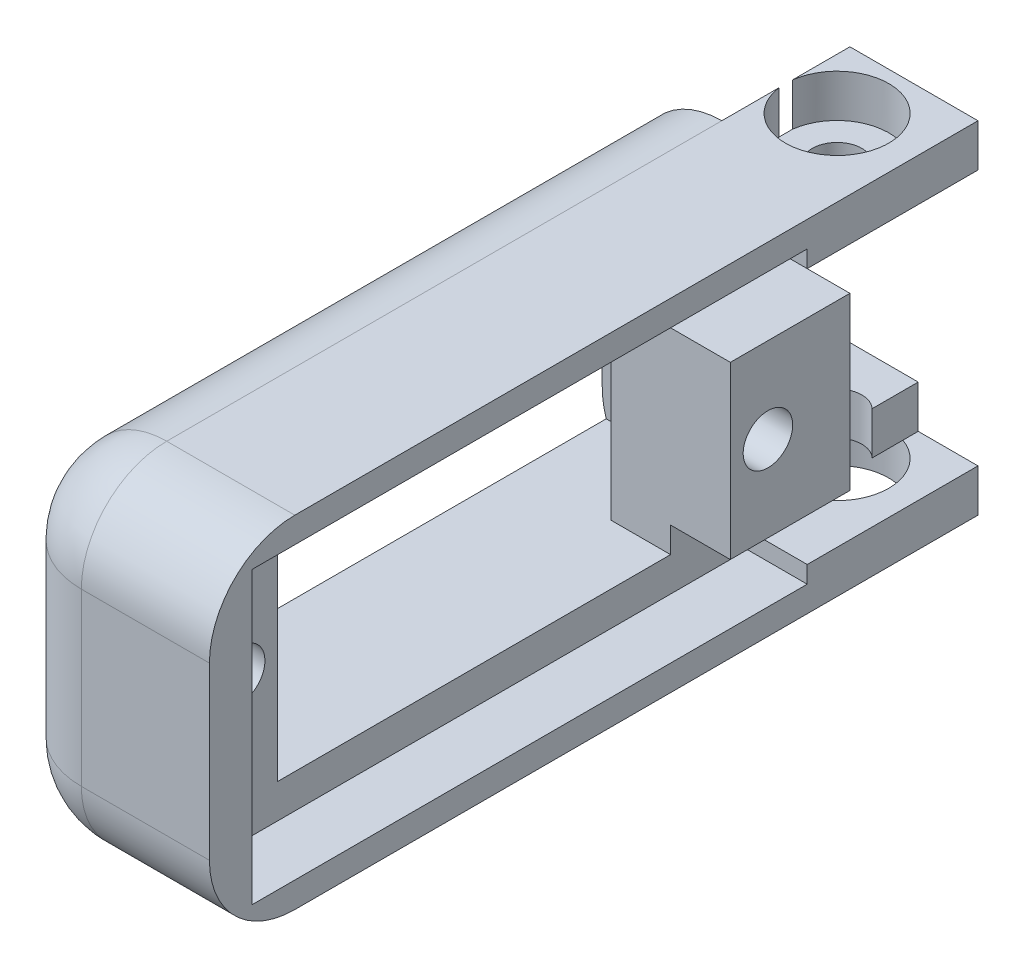
from build123d import *

# Parameters (mm, degrees)
SKETCH_1_W           = 25
SKETCH_1_H           = 37.5
EXTRUDE_1_DEPTH      = 20
FILLET_1_R           = 5
SKETCH_2_W           = 15
SKETCH_2_H           = 7.5
EXTRUDE_2_DEPTH      = 5
EXTRUDE_START        = -20
SKETCH_2_2_W         = 15
SKETCH_2_2_H         = 7.5
EXTRUDE_3_DEPTH      = 5
SKETCH_3_R           = 1.45
CUT_EXTRUDE_1_DEPTH  = 20
SKETCH_4_R           = 3.025
CUT_EXTRUDE_3_DEPTH  = 2.5
CUT_EXTRUDE_START    = -17.5
SKETCH_4_2_R         = 3.025
CUT_EXTRUDE_4_DEPTH  = 2.5
SKETCH_5_W           = 33
SKETCH_5_H           = 13
CUT_EXTRUDE_5_DEPTH  = 5.5
SKETCH_6_W           = 23
SKETCH_6_H           = 13
CUT_EXTRUDE_6_DEPTH  = 18.5
SKETCH_7_R           = 1.45
CUT_EXTRUDE_7_DEPTH  = 14.5
SKETCH_8_W           = 7
SKETCH_8_H           = 2.5
CUT_EXTRUDE_8_DEPTH  = 42.5
SKETCH_9_W           = 12
SKETCH_9_H           = 15
CUT_EXTRUDE_9_DEPTH  = 5
SKETCH_10_W          = 7
SKETCH_10_H          = 32.5
CUT_EXTRUDE_10_DEPTH = 1
CUT_EXTRUDE_START_2  = 15
SKETCH_10_2_W        = 7
SKETCH_10_2_H        = 32.5
CUT_EXTRUDE_11_DEPTH = 1
CUT_EXTRUDE_12_REACH = 40.332
SKETCH_11_R          = 3
SKETCH_12_R          = 4
EXTRUDE_4_DEPTH      = 5
SKETCH_13_W          = 22.08380712
SKETCH_13_H          = 47.260795407
CUT_EXTRUDE_13_DEPTH = 23


with BuildPart() as part:
    # Эскиз1 → Бобышка-Вытянуть1 (new body)
    with BuildSketch(Plane(origin=(0, 0, 0), x_dir=(1, 0, 0), z_dir=(0, 1, 0))):
        Rectangle(SKETCH_1_W, SKETCH_1_H)
    extrude(amount=EXTRUDE_1_DEPTH)

    # Скругление1
    fillet_1_edges = [part.edges().sort_by_distance(p)[0] for p in [
        (-12.5, 20, 0),
        (0, 20, 18.75),
        (12.5, 20, 0),
        (0, 0, 18.75),
        (-12.5, 0, 0),
        (12.5, 0, 0),
        (12.5, 10, 18.75),
        (-12.5, 10, 18.75),
    ]]
    fillet(fillet_1_edges, radius=FILLET_1_R)

    # Эскиз2 → Бобышка-Вытянуть2 (add)
    with BuildSketch(Plane(origin=(0, 20, 0), x_dir=(1, 0, 0), z_dir=(0, 1, 0))):
        with Locations((0, 22.5)):
            Rectangle(SKETCH_2_W, SKETCH_2_H)
    extrude(amount=-EXTRUDE_2_DEPTH)

    # Эскиз2<2> → Бобышка-Вытянуть3 (add)
    with BuildSketch(Plane(origin=(0, 20, 0), x_dir=(1, 0, 0), z_dir=(0, 1, 0)).offset(EXTRUDE_START)):
        with Locations((0, 22.5)):
            Rectangle(SKETCH_2_2_W, SKETCH_2_2_H)
    extrude(amount=EXTRUDE_3_DEPTH)

    # Эскиз3 → Вырез-Вытянуть1 (cut)
    with BuildSketch(Plane(origin=(0, 20, 0), x_dir=(1, 0, 0), z_dir=(0, 1, 0))):
        with Locations(Location((-4.5, 22.5, 0), (0, 0, 270))):
            Circle(SKETCH_3_R)
        with Locations(Location((4.5, 22.5, 0), (0, 0, 270))):
            Circle(SKETCH_3_R)
    extrude(amount=-CUT_EXTRUDE_1_DEPTH, mode=Mode.SUBTRACT)

    # Эскиз4 → Вырез-Вытянуть3 (cut)
    with BuildSketch(Plane(origin=(0, 20, 0), x_dir=(1, 0, 0), z_dir=(0, 1, 0))):
        with Locations((-4.5, 22.5)):
            Circle(SKETCH_4_R)
        with Locations((4.5, 22.5)):
            Circle(SKETCH_4_R)
    extrude(amount=-CUT_EXTRUDE_3_DEPTH, mode=Mode.SUBTRACT)

    # Эскиз4<2> → Вырез-Вытянуть4 (cut)
    with BuildSketch(Plane(origin=(0, 20, 0), x_dir=(1, 0, 0), z_dir=(0, 1, 0)).offset(CUT_EXTRUDE_START)):
        with Locations((-4.5, 22.5)):
            Circle(SKETCH_4_2_R)
        with Locations((4.5, 22.5)):
            Circle(SKETCH_4_2_R)
    extrude(amount=-CUT_EXTRUDE_4_DEPTH, mode=Mode.SUBTRACT)

    # Эскиз5 → Вырез-Вытянуть5 (cut)
    with BuildSketch(Plane.ZY.offset(12.5)):
        with Locations((-0.25, 10)):
            Rectangle(SKETCH_5_W, SKETCH_5_H)
    extrude(amount=-CUT_EXTRUDE_5_DEPTH, mode=Mode.SUBTRACT)

    # Эскиз6 → Вырез-Вытянуть6 (cut)
    with BuildSketch(Plane.ZY.offset(7)):
        with Locations((-0.25, 10)):
            Rectangle(SKETCH_6_W, SKETCH_6_H)
    extrude(amount=-CUT_EXTRUDE_6_DEPTH, mode=Mode.SUBTRACT)

    # Эскиз7 → Вырез-Вытянуть7 (cut)
    with BuildSketch(Plane.ZY.offset(7)):
        with Locations((-13.95, 10)):
            Circle(SKETCH_7_R)
        with Locations((13.45, 10)):
            Circle(SKETCH_7_R)
    extrude(amount=-CUT_EXTRUDE_7_DEPTH, mode=Mode.SUBTRACT)

    # Эскиз8 → Вырез-Вытянуть8 (cut)
    with BuildSketch(Plane(origin=(0, 0, -26.25), x_dir=(-1, 0, 0), z_dir=(0, 0, -1))):
        with Locations((0, 16.25)):
            Rectangle(SKETCH_8_W, SKETCH_8_H)
        with Locations((0, 3.75)):
            Rectangle(SKETCH_8_W, SKETCH_8_H)
    extrude(amount=-CUT_EXTRUDE_8_DEPTH, mode=Mode.SUBTRACT)

    # Эскиз9 → Вырез-Вытянуть9 (cut)
    with BuildSketch(Plane(origin=(0, 0, 11.25), x_dir=(-1, 0, 0), z_dir=(0, 0, -1))):
        with Locations((-2.5, 10)):
            Rectangle(SKETCH_9_W, SKETCH_9_H)
    extrude(amount=-CUT_EXTRUDE_9_DEPTH, mode=Mode.SUBTRACT)

    # Эскиз10 → Вырез-Вытянуть10 (cut)
    with BuildSketch(Plane.XZ.offset(-17.5)):
        Rectangle(SKETCH_10_W, SKETCH_10_H)
    extrude(amount=-CUT_EXTRUDE_10_DEPTH, mode=Mode.SUBTRACT)

    # Эскиз10<2> → Вырез-Вытянуть11 (cut)
    with BuildSketch(Plane.XZ.offset(-17.5).offset(CUT_EXTRUDE_START_2)):
        Rectangle(SKETCH_10_2_W, SKETCH_10_2_H)
    extrude(amount=CUT_EXTRUDE_11_DEPTH, mode=Mode.SUBTRACT)

    # Вырез-Вытянуть12: up to this face of the body (flat: up to its plane)
    cut_extrude_12_end = Plane(part.part.faces().sort_by_distance((-12.5, 10, -17.75))[0])
    # Эскиз11 → Вырез-Вытянуть12 (cut, up to the picked face)
    with BuildSketch(Plane.ZY.offset(7), mode=Mode.PRIVATE) as cut_extrude_12_sk1:
        with Locations((-13.95, 10)):
            Circle(SKETCH_11_R)
    cut_extrude_12_tool1 = split(extrude(cut_extrude_12_sk1.sketch, amount=CUT_EXTRUDE_12_REACH, mode=Mode.PRIVATE), bisect_by=cut_extrude_12_end, keep=Keep.BOTH, mode=Mode.PRIVATE)
    # Эскиз11 → Вырез-Вытянуть12 (cut, up to the picked face)
    with BuildSketch(Plane.ZY.offset(7), mode=Mode.PRIVATE) as cut_extrude_12_sk2:
        with Locations((13.45, 10)):
            Circle(SKETCH_11_R)
    cut_extrude_12_tool2 = split(extrude(cut_extrude_12_sk2.sketch, amount=CUT_EXTRUDE_12_REACH, mode=Mode.PRIVATE), bisect_by=cut_extrude_12_end, keep=Keep.BOTH, mode=Mode.PRIVATE)
    add(cut_extrude_12_tool1.solids().sort_by(Axis((-7, 10, -13.95), (-1, 0, 0)))[0], mode=Mode.SUBTRACT)
    add(cut_extrude_12_tool2.solids().sort_by(Axis((-7, 10, 13.45), (-1, 0, 0)))[0], mode=Mode.SUBTRACT)

    # Эскиз12 → Бобышка-Вытянуть4 (add)
    with BuildSketch(Plane(origin=(12.5, 0, 0), x_dir=(0, 0, -1), z_dir=(1, 0, 0))):
        with Locations(Location((-4.87, 10, 0), (0, 0, 180))):
            Circle(SKETCH_12_R)
    extrude(amount=EXTRUDE_4_DEPTH)

    # Эскиз13 → Вырез-Вытянуть13 (cut)
    with BuildSketch(Plane(origin=(0, 20, 0), x_dir=(1, 0, 0), z_dir=(0, 1, 0))):
        with Locations((11.04190356, 2.619602297)):
            Rectangle(SKETCH_13_W, SKETCH_13_H)
    extrude(amount=-CUT_EXTRUDE_13_DEPTH, mode=Mode.SUBTRACT)


solid = part.part
